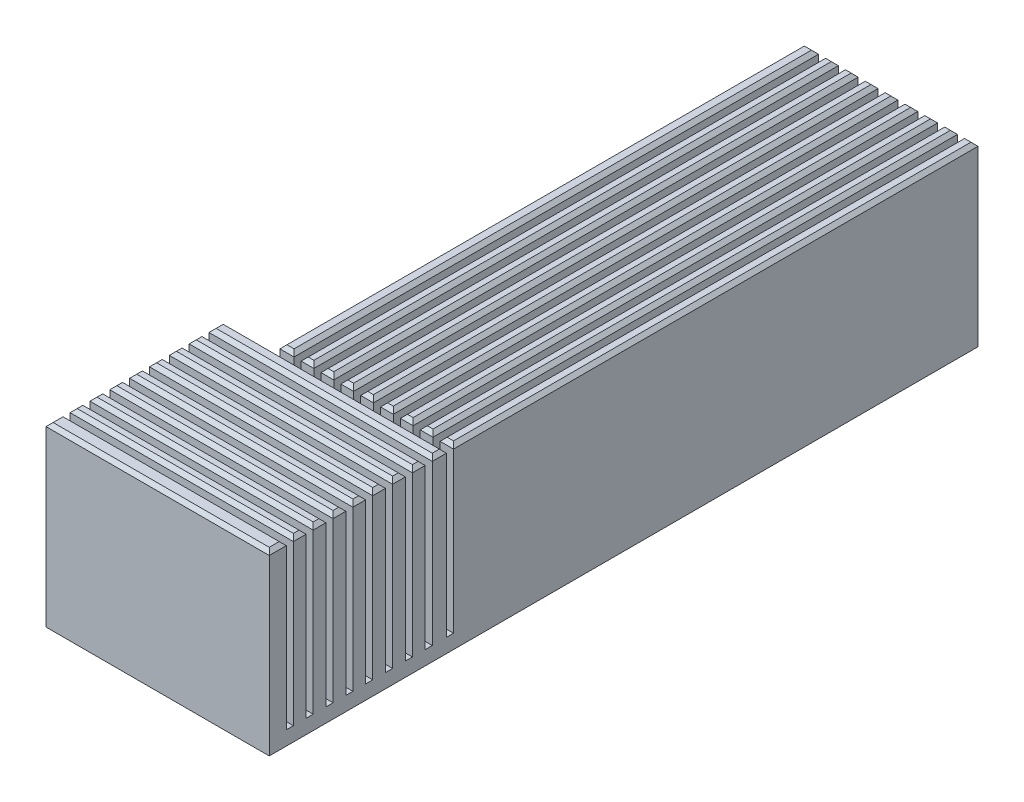
from build123d import *

# Parameters (mm, degrees)
BOSS_EXTRUDE1_DEPTH = 25
SKETCH2_W           = 1
SKETCH2_H           = 74
SKETCH2_W_2         = 31.5
SKETCH2_H_2         = 1
CUT_EXTRUDE1_DEPTH  = 23
CHAMFER1_SIZE       = 0.5


with BuildPart() as part:
    # Sketch1 → Boss-Extrude1 (new body)
    with BuildSketch(Plane(origin=(0, 0, 0), x_dir=(1, 0, 0), z_dir=(0, 1, 0))):
        Polygon((-18.647540984, 3.790983607), (-18.647540984, -21.209016393), (12.852459016, -21.209016393), (12.852459016, 78.790983607), (-11.647540984, 78.790983607), (-11.647540984, 3.790983607), align=None)
    extrude(amount=BOSS_EXTRUDE1_DEPTH)

    # Sketch2 → Cut-Extrude1 (cut)
    with BuildSketch(Plane(origin=(0, 25, 0), x_dir=(1, 0, 0), z_dir=(0, 1, 0))):
        with Locations((-9.147540984, 41.790983607)):
            Rectangle(SKETCH2_W, SKETCH2_H)
        with Locations((-6.347540984, 41.790983607)):
            Rectangle(SKETCH2_W, SKETCH2_H)
        with Locations((-3.547540984, 41.790983607)):
            Rectangle(SKETCH2_W, SKETCH2_H)
        with Locations((-0.747540984, 41.790983607)):
            Rectangle(SKETCH2_W, SKETCH2_H)
        with Locations((2.052459016, 41.790983607)):
            Rectangle(SKETCH2_W, SKETCH2_H)
        with Locations((4.852459016, 41.790983607)):
            Rectangle(SKETCH2_W, SKETCH2_H)
        with Locations((7.652459016, 41.790983607)):
            Rectangle(SKETCH2_W, SKETCH2_H)
        with Locations((10.452459016, 41.790983607)):
            Rectangle(SKETCH2_W, SKETCH2_H)
        Polygon((-11.647540984, 4.790983607), (-11.647540984, 3.790983607), (12.852459016, 3.790983607), (12.852459016, 4.790983607), (10.952459016, 4.790983607), (9.952459016, 4.790983607), (8.152459016, 4.790983607), (7.152459016, 4.790983607), (5.352459016, 4.790983607), (4.352459016, 4.790983607), (2.552459016, 4.790983607), (1.552459016, 4.790983607), (-0.247540984, 4.790983607), (-1.247540984, 4.790983607), (-3.047540984, 4.790983607), (-4.047540984, 4.790983607), (-5.847540984, 4.790983607), (-6.847540984, 4.790983607), (-8.647540984, 4.790983607), (-9.647540984, 4.790983607), align=None)
        with Locations((-2.897540984, 1.290983607)):
            Rectangle(SKETCH2_W_2, SKETCH2_H_2)
        with Locations((-2.897540984, -1.509016393)):
            Rectangle(SKETCH2_W_2, SKETCH2_H_2)
        with Locations((-2.897540984, -4.309016393)):
            Rectangle(SKETCH2_W_2, SKETCH2_H_2)
        with Locations((-2.897540984, -7.109016393)):
            Rectangle(SKETCH2_W_2, SKETCH2_H_2)
        with Locations((-2.897540984, -9.909016393)):
            Rectangle(SKETCH2_W_2, SKETCH2_H_2)
        with Locations((-2.897540984, -18.309016393)):
            Rectangle(SKETCH2_W_2, SKETCH2_H_2)
        with Locations((-2.897540984, -15.509016393)):
            Rectangle(SKETCH2_W_2, SKETCH2_H_2)
        with Locations((-2.897540984, -12.709016393)):
            Rectangle(SKETCH2_W_2, SKETCH2_H_2)
    extrude(amount=-CUT_EXTRUDE1_DEPTH, mode=Mode.SUBTRACT)

    # Chamfer1
    chamfer1_edges = [part.edges().sort_by_distance(p)[0] for p in [
        (5.352459016, 25, -41.790983607),
        (6.252459016, 25, -4.790983607),
        (8.152459016, 25, -41.790983607),
        (9.052459016, 25, -4.790983607),
        (10.952459016, 25, -41.790983607),
        (11.902459016, 25, -4.790983607),
        (-10.647540984, 25, -4.790983607),
        (-9.647540984, 25, -41.790983607),
        (9.952459016, 25, -41.790983607),
        (7.152459016, 25, -41.790983607),
        (4.352459016, 25, -41.790983607),
        (1.552459016, 25, -41.790983607),
        (-1.247540984, 25, -41.790983607),
        (-4.047540984, 25, -41.790983607),
        (-2.897540984, 25, 21.209016393),
        (-6.847540984, 25, -41.790983607),
        (-2.897540984, 25, -1.790983607),
        (-2.897540984, 25, -0.790983607),
        (12.852459016, 25, 20.009016393),
        (-2.897540984, 25, 1.009016393),
        (-2.897540984, 25, 2.009016393),
        (-2.897540984, 25, 3.809016393),
        (-2.897540984, 25, 4.809016393),
        (-2.897540984, 25, 6.609016393),
        (-2.897540984, 25, 7.609016393),
        (-2.897540984, 25, 12.209016393),
        (-2.897540984, 25, 13.209016393),
        (-18.647540984, 25, 0.109016393),
        (-2.897540984, 25, 15.009016393),
        (-2.897540984, 25, 16.009016393),
        (-18.647540984, 25, 2.909016393),
        (-2.897540984, 25, 17.809016393),
        (-2.897540984, 25, 18.809016393),
        (-18.647540984, 25, 5.709016393),
        (-2.897540984, 25, 9.409016393),
        (11.902459016, 25, -78.790983607),
        (-2.897540984, 25, 10.409016393),
        (-18.647540984, 25, 8.509016393),
        (-18.647540984, 25, 11.309016393),
        (-18.647540984, 25, 14.109016393),
        (-18.647540984, 25, 16.909016393),
        (-18.647540984, 25, 20.009016393),
        (12.852459016, 25, 16.909016393),
        (12.852459016, 25, 14.109016393),
        (-11.647540984, 25, -41.790983607),
        (12.852459016, 25, 11.309016393),
        (12.852459016, 25, 8.509016393),
        (12.852459016, 25, 5.709016393),
        (12.852459016, 25, 2.909016393),
        (12.852459016, 25, 0.109016393),
        (12.852459016, 25, -2.790983607),
        (12.852459016, 25, -41.790983607),
        (9.052459016, 25, -78.790983607),
        (6.252459016, 25, -78.790983607),
        (3.452459016, 25, -78.790983607),
        (0.652459016, 25, -78.790983607),
        (-2.147540984, 25, -78.790983607),
        (-4.947540984, 25, -78.790983607),
        (-7.747540984, 25, -78.790983607),
        (-10.647540984, 25, -78.790983607),
        (-2.897540984, 25, -3.790983607),
        (-8.647540984, 25, -41.790983607),
        (-7.747540984, 25, -4.790983607),
        (-18.647540984, 25, -2.790983607),
        (-5.847540984, 25, -41.790983607),
        (-4.947540984, 25, -4.790983607),
        (-3.047540984, 25, -41.790983607),
        (-2.147540984, 25, -4.790983607),
        (-0.247540984, 25, -41.790983607),
        (0.652459016, 25, -4.790983607),
        (2.552459016, 25, -41.790983607),
        (3.452459016, 25, -4.790983607),
    ]]
    chamfer(chamfer1_edges, length=CHAMFER1_SIZE)


solid = part.part
